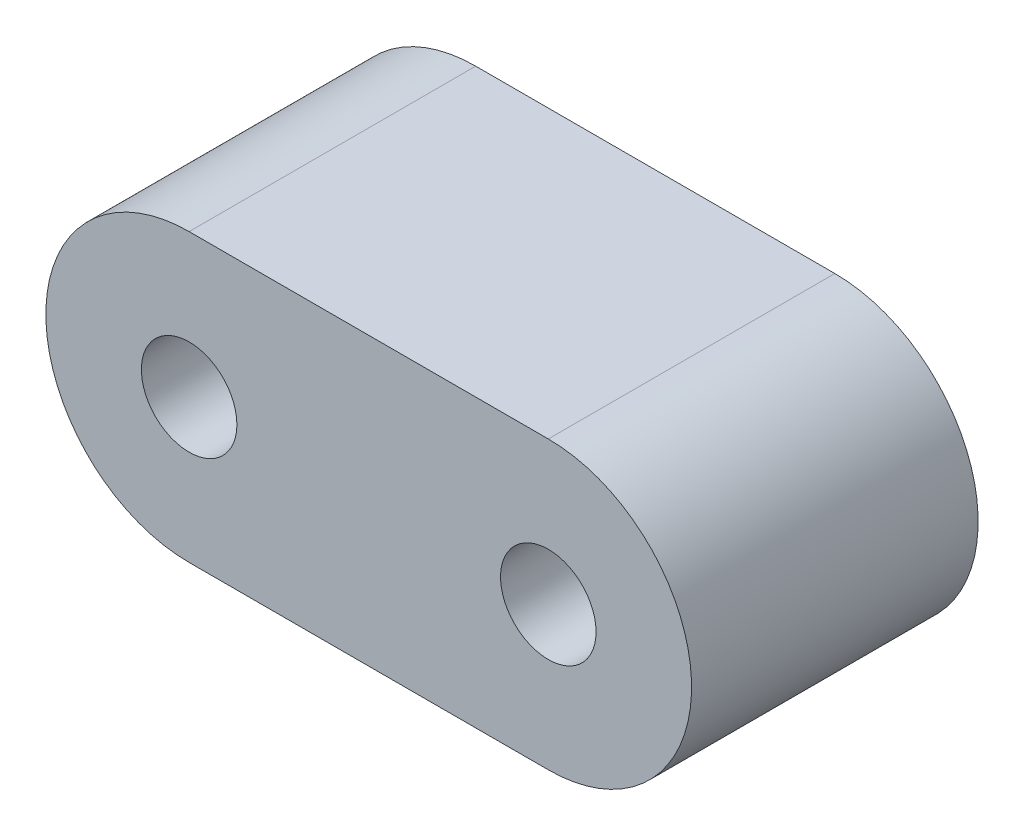
from build123d import *

# Parameters (mm, degrees)
SKETCH1_R           = 0.5
BOSS_EXTRUDE1_DEPTH = 1.5


with BuildPart() as part:
    # Sketch1 → Boss-Extrude1 (new, symmetric)
    with BuildSketch(Plane.XY):
        with BuildLine():
            Line((0, 1.5), (3.76, 1.5))
            ThreePointArc((3.76, 1.5), (5.26, 0), (3.76, -1.5))
            Line((3.76, -1.5), (0, -1.5))
            ThreePointArc((0, -1.5), (-1.5, 0), (0, 1.5))
        make_face()
        Circle(SKETCH1_R, mode=Mode.SUBTRACT)
        with Locations((3.76, 0)):
            Circle(SKETCH1_R, mode=Mode.SUBTRACT)
    extrude(amount=BOSS_EXTRUDE1_DEPTH, both=True)


solid = part.part
